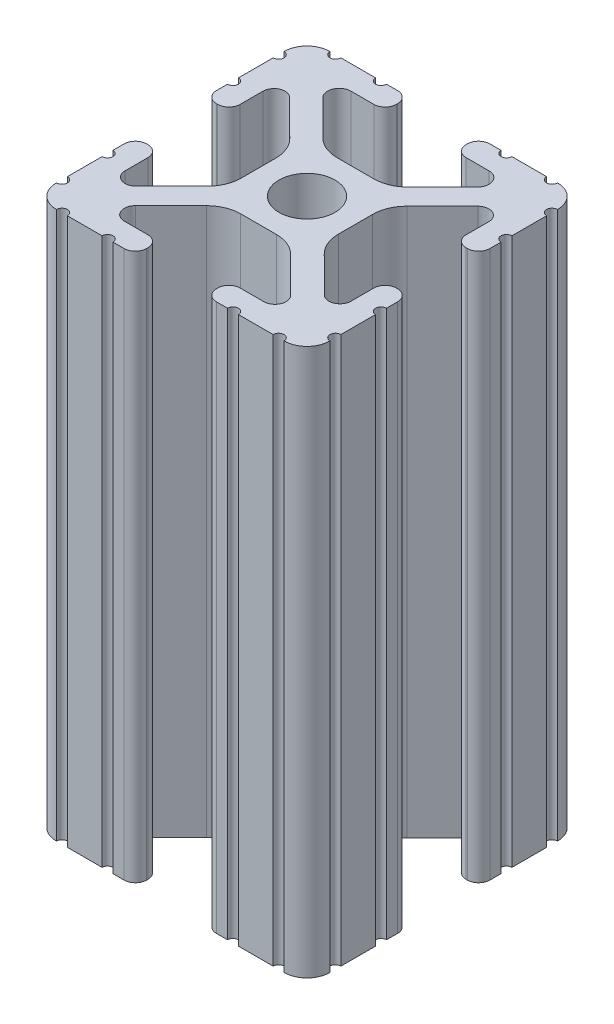
from build123d import *

# Parameters (mm, degrees)
SKETCH12_R                = 2.6035
F_10_1010_PROFILE_1_DEPTH = 50.8


with BuildPart() as part:
    # Sketch12 → 10 1010 PROFILE(1) (new body)
    with BuildSketch(Plane(origin=(0, 0, 0), x_dir=(-1, 0, 0), z_dir=(0, 1, 0))):
        with BuildLine():
            Line((-1.709253557, -4.4958), (1.709253557, -4.4958))
            ThreePointArc((1.709253557, -4.4958), (2.922935876, -4.736928798), (3.95226937, -5.423689619))
            Line((3.95226937, -5.423689619), (7.179652728, -8.645192207))
            ThreePointArc((7.179652728, -8.645192207), (7.414733441, -9.822812921), (6.41641086, -10.4902))
            Line((6.41641086, -10.4902), (4.28752, -10.4902))
            ThreePointArc((4.28752, -10.4902), (3.545750844, -10.797450844), (3.2385, -11.53922))
            Line((3.2385, -11.53922), (3.2385, -11.65098))
            ThreePointArc((3.2385, -11.65098), (3.545750844, -12.392749156), (4.28752, -12.7))
            Line((4.28752, -12.7), (5.3171344, -12.7))
            ThreePointArc((5.3171344, -12.7), (5.8251344, -12.192), (6.3331344, -12.7))
            Line((6.3331344, -12.7), (9.5504, -12.7))
            ThreePointArc((9.5504, -12.7), (10.058323491, -12.192000006), (10.566399977, -12.699846982))
            ThreePointArc((10.566399977, -12.699846982), (12.082522516, -12.082522516), (12.699846982, -10.566399977))
            ThreePointArc((12.699846982, -10.566399977), (12.192000006, -10.058323491), (12.7, -9.5504))
            Line((12.7, -9.5504), (12.7, -6.3330836))
            ThreePointArc((12.7, -6.3330836), (12.192, -5.8250836), (12.7, -5.3170836))
            Line((12.7, -5.3170836), (12.7, -4.287470133))
            ThreePointArc((12.7, -4.287470133), (12.392749156, -3.545700977), (11.65098, -3.238450133))
            Line((11.65098, -3.238450133), (11.53922, -3.238450133))
            ThreePointArc((11.53922, -3.238450133), (10.797450844, -3.545700977), (10.4902, -4.287470133))
            Line((10.4902, -4.287470133), (10.4902, -6.402089023))
            ThreePointArc((10.4902, -6.402089023), (9.856394933, -7.351113629), (8.736962546, -7.129240479))
            Line((8.736962546, -7.129240479), (5.440484187, -3.838768792))
            ThreePointArc((5.440484187, -3.838768792), (4.75073678, -2.808015636), (4.5085, -1.591658411))
            Line((4.5085, -1.591658411), (4.5085, 1.591658411))
            ThreePointArc((4.5085, 1.591658411), (4.75073678, 2.808015636), (5.440484187, 3.838768792))
            Line((5.440484187, 3.838768792), (8.736962546, 7.129240479))
            ThreePointArc((8.736962546, 7.129240479), (9.856394933, 7.351113629), (10.4902, 6.402089023))
            Line((10.4902, 6.402089023), (10.4902, 4.287470133))
            ThreePointArc((10.4902, 4.287470133), (10.797450844, 3.545700977), (11.53922, 3.238450133))
            Line((11.53922, 3.238450133), (11.65098, 3.238450133))
            ThreePointArc((11.65098, 3.238450133), (12.392749156, 3.545700977), (12.7, 4.287470133))
            Line((12.7, 4.287470133), (12.7, 5.3171344))
            ThreePointArc((12.7, 5.3171344), (12.192, 5.8251344), (12.7, 6.3331344))
            Line((12.7, 6.3331344), (12.7, 9.5504))
            ThreePointArc((12.7, 9.5504), (12.192000006, 10.058323491), (12.699846982, 10.566399977))
            ThreePointArc((12.699846982, 10.566399977), (12.082522516, 12.082522516), (10.566399977, 12.699846982))
            ThreePointArc((10.566399977, 12.699846982), (10.058323491, 12.192000006), (9.5504, 12.7))
            Line((9.5504, 12.7), (6.3330836, 12.7))
            ThreePointArc((6.3330836, 12.7), (5.8250836, 12.192), (5.3170836, 12.7))
            Line((5.3170836, 12.7), (4.2874692, 12.7))
            ThreePointArc((4.2874692, 12.7), (3.545700044, 12.392749156), (3.2384492, 11.65098))
            Line((3.2384492, 11.65098), (3.2384492, 11.53922))
            ThreePointArc((3.2384492, 11.53922), (3.545700044, 10.797450844), (4.2874692, 10.4902))
            Line((4.2874692, 10.4902), (6.476774195, 10.4902))
            ThreePointArc((6.476774195, 10.4902), (7.43216212, 9.851515102), (7.207191475, 8.724540082))
            Line((7.207191475, 8.724540082), (3.900315394, 5.423689619))
            ThreePointArc((3.900315394, 5.423689619), (2.8709819, 4.736928798), (1.657299581, 4.4958))
            Line((1.657299581, 4.4958), (-1.657299581, 4.4958))
            ThreePointArc((-1.657299581, 4.4958), (-2.8709819, 4.736928798), (-3.900315394, 5.423689619))
            Line((-3.900315394, 5.423689619), (-7.207191475, 8.724540082))
            ThreePointArc((-7.207191475, 8.724540082), (-7.43216212, 9.851515102), (-6.476774195, 10.4902))
            Line((-6.476774195, 10.4902), (-4.2874692, 10.4902))
            ThreePointArc((-4.2874692, 10.4902), (-3.545700044, 10.797450844), (-3.2384492, 11.53922))
            Line((-3.2384492, 11.53922), (-3.2384492, 11.65098))
            ThreePointArc((-3.2384492, 11.65098), (-3.545700044, 12.392749156), (-4.2874692, 12.7))
            Line((-4.2874692, 12.7), (-5.3170836, 12.7))
            ThreePointArc((-5.3170836, 12.7), (-5.8250836, 12.192), (-6.3330836, 12.7))
            Line((-6.3330836, 12.7), (-9.5504, 12.7))
            ThreePointArc((-9.5504, 12.7), (-10.058323491, 12.192000006), (-10.566399977, 12.699846982))
            ThreePointArc((-10.566399977, 12.699846982), (-12.082522516, 12.082522516), (-12.699846982, 10.566399977))
            ThreePointArc((-12.699846982, 10.566399977), (-12.192000006, 10.058323491), (-12.7, 9.5504))
            Line((-12.7, 9.5504), (-12.7, 6.3331344))
            ThreePointArc((-12.7, 6.3331344), (-12.192, 5.8251344), (-12.7, 5.3171344))
            Line((-12.7, 5.3171344), (-12.7, 4.287470133))
            ThreePointArc((-12.7, 4.287470133), (-12.392749156, 3.545700977), (-11.65098, 3.238450133))
            Line((-11.65098, 3.238450133), (-11.53922, 3.238450133))
            ThreePointArc((-11.53922, 3.238450133), (-10.797450844, 3.545700977), (-10.4902, 4.287470133))
            Line((-10.4902, 4.287470133), (-10.4902, 6.402089023))
            ThreePointArc((-10.4902, 6.402089023), (-9.856394933, 7.351113629), (-8.736962546, 7.129240479))
            Line((-8.736962546, 7.129240479), (-5.440484187, 3.838768792))
            ThreePointArc((-5.440484187, 3.838768792), (-4.75073678, 2.808015636), (-4.5085, 1.591658411))
            Line((-4.5085, 1.591658411), (-4.5085, -1.591658411))
            ThreePointArc((-4.5085, -1.591658411), (-4.75073678, -2.808015636), (-5.440484187, -3.838768792))
            Line((-5.440484187, -3.838768792), (-8.736962546, -7.129240479))
            ThreePointArc((-8.736962546, -7.129240479), (-9.856394933, -7.351113629), (-10.4902, -6.402089023))
            Line((-10.4902, -6.402089023), (-10.4902, -4.287470133))
            ThreePointArc((-10.4902, -4.287470133), (-10.797450844, -3.545700977), (-11.53922, -3.238450133))
            Line((-11.53922, -3.238450133), (-11.65098, -3.238450133))
            ThreePointArc((-11.65098, -3.238450133), (-12.392749156, -3.545700977), (-12.7, -4.287470133))
            Line((-12.7, -4.287470133), (-12.7, -5.3170836))
            ThreePointArc((-12.7, -5.3170836), (-12.192, -5.8250836), (-12.7, -6.3330836))
            Line((-12.7, -6.3330836), (-12.7, -9.5504))
            ThreePointArc((-12.7, -9.5504), (-12.192000006, -10.058323491), (-12.699846982, -10.566399977))
            ThreePointArc((-12.699846982, -10.566399977), (-12.082522516, -12.082522516), (-10.566399977, -12.699846982))
            ThreePointArc((-10.566399977, -12.699846982), (-10.058323491, -12.192000006), (-9.5504, -12.7))
            Line((-9.5504, -12.7), (-6.3331344, -12.7))
            ThreePointArc((-6.3331344, -12.7), (-5.8251344, -12.192), (-5.3171344, -12.7))
            Line((-5.3171344, -12.7), (-4.28752, -12.7))
            ThreePointArc((-4.28752, -12.7), (-3.545750844, -12.392749156), (-3.2385, -11.65098))
            Line((-3.2385, -11.65098), (-3.2385, -11.53922))
            ThreePointArc((-3.2385, -11.53922), (-3.545750844, -10.797450844), (-4.28752, -10.4902))
            Line((-4.28752, -10.4902), (-6.41641086, -10.4902))
            ThreePointArc((-6.41641086, -10.4902), (-7.414733441, -9.822812921), (-7.179652728, -8.645192207))
            Line((-7.179652728, -8.645192207), (-3.95226937, -5.423689619))
            ThreePointArc((-3.95226937, -5.423689619), (-2.922935876, -4.736928798), (-1.709253557, -4.4958))
        make_face()
        Circle(SKETCH12_R, mode=Mode.SUBTRACT)
    extrude(amount=F_10_1010_PROFILE_1_DEPTH)


solid = part.part
